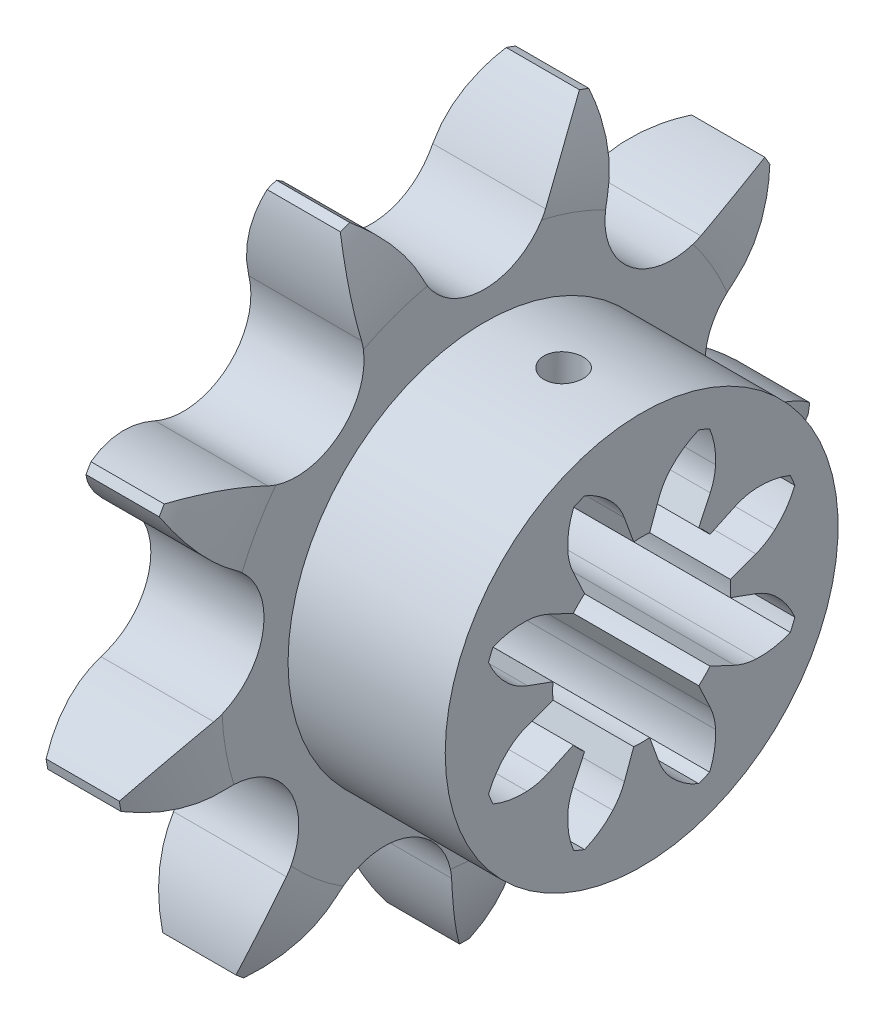
from build123d import *

# Parameters (mm, degrees)
CORTE_EXTRUS_O1_DEPTH     = 34.015232275
PADR_OCIRCULAR1_COUNT     = 9
CORTE_EXTRUS_O2_START     = -7.2
CORTE_EXTRUS_O2_DEPTH     = 41.023702102
FURO_ROSCADO_DE_M32_D     = 2.5
FURO_ROSCADO_DE_M32_DEPTH = 8.5
FURO_ROSCADO_DE_M32_TIP   = 0.751075774


with BuildPart() as part:
    # Esboço1 → Revolução1 (revolve)
    with BuildSketch(Plane.XY, mode=Mode.PRIVATE) as revolu_o1_sk:
        with BuildLine():
            Line((0, 0), (0, 16.712856303))
            ThreePointArc((0, 16.712856303), (0.321571182, 19.552662635), (1.27, 22.248657961))
            Line((1.27, 22.248657961), (5.93, 22.248657961))
            ThreePointArc((5.93, 22.248657961), (6.878428818, 19.552662635), (7.2, 16.712856303))
            Line((7.2, 16.712856303), (7.2, 12.5))
            Line((7.2, 12.5), (17.2, 12.5))
            Line((17.2, 12.5), (17.2, 0))
            Line((17.2, 0), (0, 0))
        make_face()
    revolve(revolu_o1_sk.sketch.rotate(Axis((-35, 0, 0), (1, 0, 0)), 90), axis=Axis((-35, 0, 0), (1, 0, 0)))

    # Esboço2 → Corte-extrusão1 (cut, through all)
    with BuildSketch(Plane(origin=(7.2, 0, 0), x_dir=(0, 0, -1), z_dir=(1, 0, 0))):
        with BuildLine():
            ThreePointArc((3.89490303, 16.792484851), (5.53909395, 19.346647696), (7.807509589, 21.366895728))
            ThreePointArc((7.807509589, 21.366895728), (0, 22.748657961), (-7.807509589, 21.366895728))
            ThreePointArc((-7.807509589, 21.366895728), (-5.53909395, 19.346647696), (-3.89490303, 16.792484851))
            ThreePointArc((-3.89490303, 16.792484851), (0, 14.311157961), (3.89490303, 16.792484851))
        make_face()
    corte_extrus_o1 = extrude(amount=-CORTE_EXTRUS_O1_DEPTH, mode=Mode.SUBTRACT)

    # PadrãoCircular1: Corte-extrusão1 ×9 about axis
    padr_ocircular1_axis = Axis((0, 0, 0), (1, 0, 0))
    for i in range(1, PADR_OCIRCULAR1_COUNT):
        add(corte_extrus_o1.rotate(padr_ocircular1_axis, i * 360 / PADR_OCIRCULAR1_COUNT), mode=Mode.SUBTRACT)

    # Esboço3 → Corte-extrusão2 (cut, through all)
    with BuildSketch(Plane(origin=(7.2, 0, 0), x_dir=(0, 0, -1), z_dir=(1, 0, 0)).offset(CORTE_EXTRUS_O2_START)):
        with BuildLine():
            Line((-0.506751832, 5.642289215), (-1.097919721, 7.266509641))
            ThreePointArc((-1.097919721, 7.266509641), (-1.406126414, 7.910707201), (-1.832951119, 8.483247621))
            ThreePointArc((-1.832951119, 8.483247621), (-2.661618953, 9.214061597), (-3.630088541, 9.745894376))
            ThreePointArc((-3.630088541, 9.745894376), (-3.979907697, 9.608347138), (-4.324527778, 9.458248225))
            ThreePointArc((-4.324527778, 9.458248225), (-4.633276627, 8.397374248), (-4.702469753, 7.294654085))
            ThreePointArc((-4.702469753, 7.294654085), (-4.599433183, 6.587996228), (-4.361851763, 5.914544723))
            Line((-4.361851763, 5.914544723), (-3.631373309, 4.348028622))
            ThreePointArc((-3.631373309, 4.348028622), (-4.005759915, 4.005759915), (-4.348028622, 3.631373309))
            Line((-4.348028622, 3.631373309), (-5.914544723, 4.361851763))
            ThreePointArc((-5.914544723, 4.361851763), (-6.587996228, 4.599433183), (-7.294654085, 4.702469753))
            ThreePointArc((-7.294654085, 4.702469753), (-8.397374248, 4.633276627), (-9.458248225, 4.324527778))
            ThreePointArc((-9.458248225, 4.324527778), (-9.608347138, 3.979907697), (-9.745894376, 3.630088541))
            ThreePointArc((-9.745894376, 3.630088541), (-9.214061597, 2.661618953), (-8.483247621, 1.832951119))
            ThreePointArc((-8.483247621, 1.832951119), (-7.910707201, 1.406126414), (-7.266509641, 1.097919721))
            Line((-7.266509641, 1.097919721), (-5.642289215, 0.506751832))
            ThreePointArc((-5.642289215, 0.506751832), (-5.665, 0), (-5.642289215, -0.506751832))
            Line((-5.642289215, -0.506751832), (-7.266509641, -1.097919721))
            ThreePointArc((-7.266509641, -1.097919721), (-7.910707201, -1.406126414), (-8.483247621, -1.832951119))
            ThreePointArc((-8.483247621, -1.832951119), (-9.214061597, -2.661618953), (-9.745894376, -3.630088541))
            ThreePointArc((-9.745894376, -3.630088541), (-9.608347138, -3.979907697), (-9.458248225, -4.324527778))
            ThreePointArc((-9.458248225, -4.324527778), (-8.397374248, -4.633276627), (-7.294654085, -4.702469753))
            ThreePointArc((-7.294654085, -4.702469753), (-6.587996228, -4.599433183), (-5.914544723, -4.361851763))
            Line((-5.914544723, -4.361851763), (-4.348028622, -3.631373309))
            ThreePointArc((-4.348028622, -3.631373309), (-4.005759915, -4.005759915), (-3.631373309, -4.348028622))
            Line((-3.631373309, -4.348028622), (-4.361851763, -5.914544723))
            ThreePointArc((-4.361851763, -5.914544723), (-4.599433183, -6.587996228), (-4.702469753, -7.294654085))
            ThreePointArc((-4.702469753, -7.294654085), (-4.633276627, -8.397374248), (-4.324527778, -9.458248225))
            ThreePointArc((-4.324527778, -9.458248225), (-3.979907697, -9.608347138), (-3.630088541, -9.745894376))
            ThreePointArc((-3.630088541, -9.745894376), (-2.661618953, -9.214061597), (-1.832951119, -8.483247621))
            ThreePointArc((-1.832951119, -8.483247621), (-1.406126414, -7.910707201), (-1.097919721, -7.266509641))
            Line((-1.097919721, -7.266509641), (-0.506751832, -5.642289215))
            ThreePointArc((-0.506751832, -5.642289215), (0, -5.665), (0.506751832, -5.642289215))
            Line((0.506751832, -5.642289215), (1.097919721, -7.266509641))
            ThreePointArc((1.097919721, -7.266509641), (1.406126414, -7.910707201), (1.832951119, -8.483247621))
            ThreePointArc((1.832951119, -8.483247621), (2.661618953, -9.214061597), (3.630088541, -9.745894376))
            ThreePointArc((3.630088541, -9.745894376), (3.979907697, -9.608347138), (4.324527778, -9.458248225))
            ThreePointArc((4.324527778, -9.458248225), (4.633276627, -8.397374248), (4.702469753, -7.294654085))
            ThreePointArc((4.702469753, -7.294654085), (4.599433183, -6.587996228), (4.361851763, -5.914544723))
            Line((4.361851763, -5.914544723), (3.631373309, -4.348028622))
            ThreePointArc((3.631373309, -4.348028622), (4.005759915, -4.005759915), (4.348028622, -3.631373309))
            Line((4.348028622, -3.631373309), (5.914544723, -4.361851763))
            ThreePointArc((5.914544723, -4.361851763), (6.587996228, -4.599433183), (7.294654085, -4.702469753))
            ThreePointArc((7.294654085, -4.702469753), (8.397374248, -4.633276627), (9.458248225, -4.324527778))
            ThreePointArc((9.458248225, -4.324527778), (9.608347138, -3.979907697), (9.745894376, -3.630088541))
            ThreePointArc((9.745894376, -3.630088541), (9.214061597, -2.661618953), (8.483247621, -1.832951119))
            ThreePointArc((8.483247621, -1.832951119), (7.910707201, -1.406126414), (7.266509641, -1.097919721))
            Line((7.266509641, -1.097919721), (5.642289215, -0.506751832))
            ThreePointArc((5.642289215, -0.506751832), (5.665, 0), (5.642289215, 0.506751832))
            Line((5.642289215, 0.506751832), (7.266509641, 1.097919721))
            ThreePointArc((7.266509641, 1.097919721), (7.910707201, 1.406126414), (8.483247621, 1.832951119))
            ThreePointArc((8.483247621, 1.832951119), (9.214061597, 2.661618953), (9.745894376, 3.630088541))
            ThreePointArc((9.745894376, 3.630088541), (9.608347138, 3.979907697), (9.458248225, 4.324527778))
            ThreePointArc((9.458248225, 4.324527778), (8.397374248, 4.633276627), (7.294654085, 4.702469753))
            ThreePointArc((7.294654085, 4.702469753), (6.587996228, 4.599433183), (5.914544723, 4.361851763))
            Line((5.914544723, 4.361851763), (4.348028622, 3.631373309))
            ThreePointArc((4.348028622, 3.631373309), (4.005759915, 4.005759915), (3.631373309, 4.348028622))
            Line((3.631373309, 4.348028622), (4.361851763, 5.914544723))
            ThreePointArc((4.361851763, 5.914544723), (4.599433183, 6.587996228), (4.702469753, 7.294654085))
            ThreePointArc((4.702469753, 7.294654085), (4.633276627, 8.397374248), (4.324527778, 9.458248225))
            ThreePointArc((4.324527778, 9.458248225), (3.979907697, 9.608347138), (3.630088541, 9.745894376))
            ThreePointArc((3.630088541, 9.745894376), (2.661618953, 9.214061597), (1.832951119, 8.483247621))
            ThreePointArc((1.832951119, 8.483247621), (1.406126414, 7.910707201), (1.097919721, 7.266509641))
            Line((1.097919721, 7.266509641), (0.506751832, 5.642289215))
            ThreePointArc((0.506751832, 5.642289215), (0, 5.665), (-0.506751832, 5.642289215))
        make_face()
    extrude(amount=CORTE_EXTRUS_O2_DEPTH, mode=Mode.SUBTRACT)

    # Furo roscado de M32
    with Locations(Plane(origin=(12.2, 12.499949484, -0.035537109), x_dir=(0, 0.002842968738, 0.999995958756), z_dir=(0, 0.999995958756, -0.002842968738))):
        with Locations((0, 0)):
            Hole(FURO_ROSCADO_DE_M32_D / 2, depth=FURO_ROSCADO_DE_M32_DEPTH)
            with Locations((0, 0, -(FURO_ROSCADO_DE_M32_DEPTH + FURO_ROSCADO_DE_M32_TIP / 2))):  # 118° drill point
                Cone(0, FURO_ROSCADO_DE_M32_D / 2, FURO_ROSCADO_DE_M32_TIP, mode=Mode.SUBTRACT)


solid = part.part
